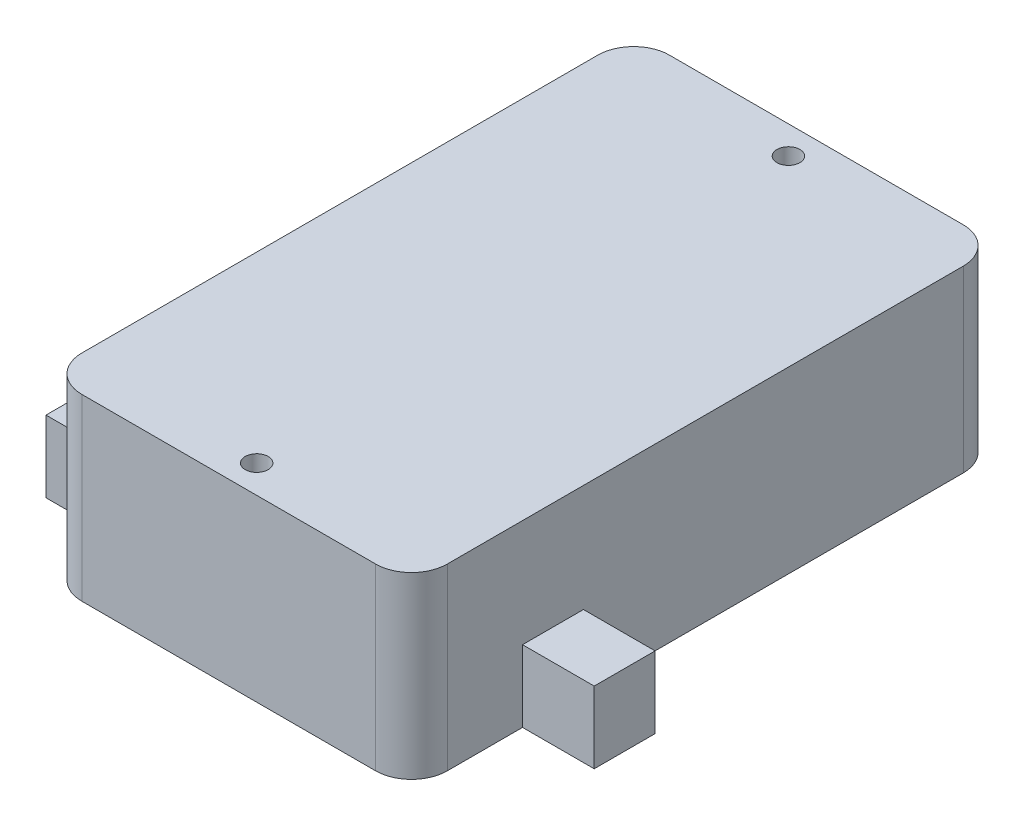
from build123d import *

# Parameters (mm, degrees)
SKETCH1_R           = 1.6
BOSS_EXTRUDE1_DEPTH = 25
SKETCH1_3_W         = 10
SKETCH1_3_H         = 26
SKETCH1_3_H_2       = 8.5
BOSS_EXTRUDE2_DEPTH = 10
FILLET1_R           = 5


with BuildPart() as part:
    # Sketch1 → Boss-Extrude1 (new body)
    with BuildSketch(Plane(origin=(0, 0, 0), x_dir=(1, 0, 0), z_dir=(0, 1, 0))):
        Polygon((-25.5, -31), (-25.5, -41), (25.5, -41), (25.5, -25.5), (25.5, -17), (25.5, 41), (-25.5, 41), (-25.5, -5), align=None)
        with Locations((0, -37.1)):
            Circle(SKETCH1_R, mode=Mode.SUBTRACT)
        with Locations((0, 37.1)):
            Circle(SKETCH1_R, mode=Mode.SUBTRACT)
    extrude(amount=BOSS_EXTRUDE1_DEPTH)

    # Sketch1<3> → Boss-Extrude2 (add)
    with BuildSketch(Plane(origin=(0, 0, 0), x_dir=(1, 0, 0), z_dir=(0, 1, 0))):
        with Locations((-30.5, -18)):
            Rectangle(SKETCH1_3_W, SKETCH1_3_H)
        with Locations((30.5, -21.25)):
            Rectangle(SKETCH1_3_W, SKETCH1_3_H_2)
    extrude(amount=BOSS_EXTRUDE2_DEPTH)

    # Fillet1
    fillet1_edges = [part.edges().sort_by_distance(p)[0] for p in [
        (-25.5, 12.5, -41),
        (25.5, 12.5, -41),
        (25.5, 12.5, 41),
        (-25.5, 12.5, 41),
    ]]
    fillet(fillet1_edges, radius=FILLET1_R)


solid = part.part
